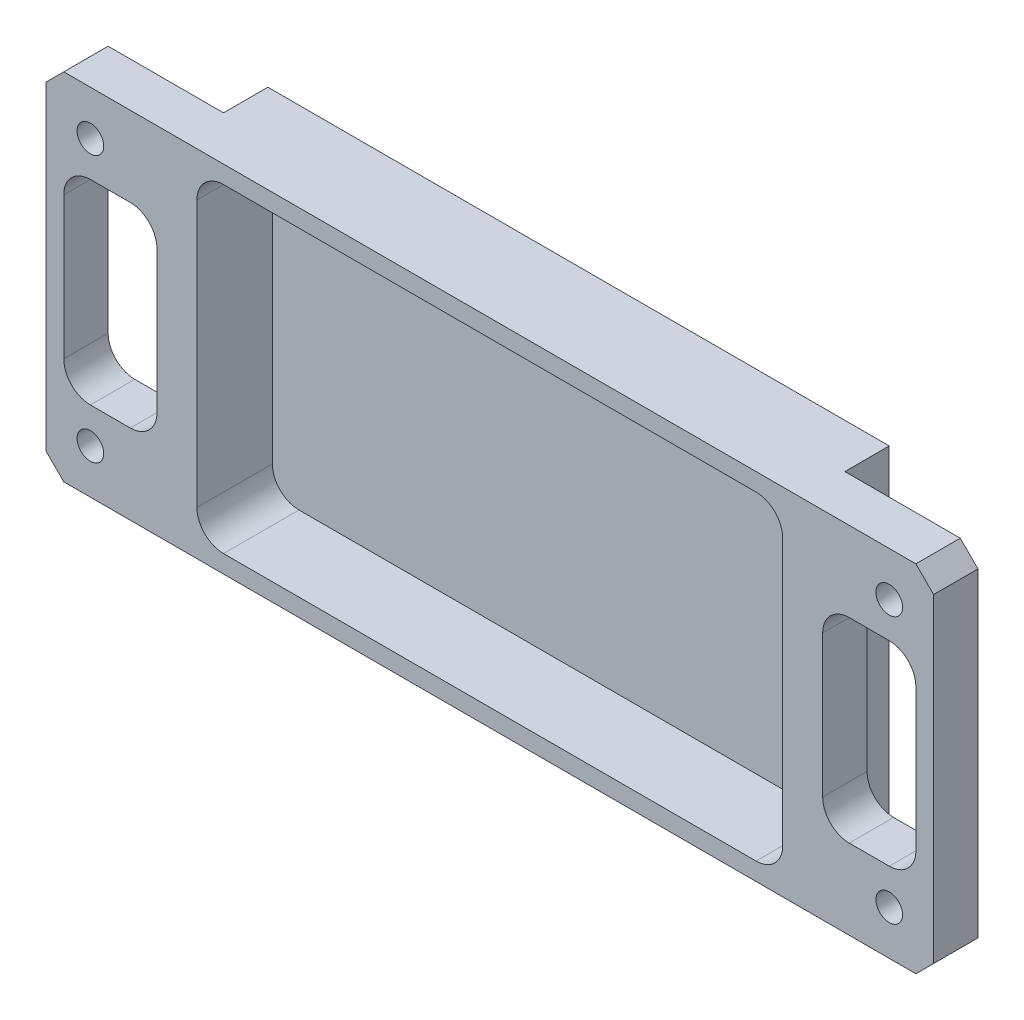
from build123d import *

# Parameters (mm, degrees)
AUFSATZ_LINEAR_AUSTRAGEN1_DEPTH      = 2.5
AUFSATZ_LINEAR_AUSTRAGEN1_DEPTH_BACK = 2.5
SKIZZE1_W                            = 100
SKIZZE1_H                            = 40
SCHNITT_LINEAR_AUSTRAGEN1_DEPTH      = 54.909646632
SCHNITT_LINEAR_AUSTRAGEN1_DEPTH_BACK = 54.909646632
SKIZZE2_R                            = 1.5
SCHNITT_LINEAR_AUSTRAGEN2_DEPTH      = 54.909646632
SCHNITT_LINEAR_AUSTRAGEN2_DEPTH_BACK = 54.909646632
SKIZZE7_W                            = 70
SKIZZE7_H                            = 40
AUFSATZ_LINEAR_AUSTRAGEN3_DEPTH      = 5
SCHNITT_LINEAR_AUSTRAGEN6_DEPTH      = 8.5
FASE1_SIZE                           = 2


with BuildPart() as part:
    # Skizze1 → Aufsatz-Linear austragen1 (new, two sides: drawn at the far end of the back side and taken through both)
    with BuildSketch(Plane.XY.offset(-AUFSATZ_LINEAR_AUSTRAGEN1_DEPTH_BACK)):
        Rectangle(SKIZZE1_W, SKIZZE1_H)
    extrude(amount=AUFSATZ_LINEAR_AUSTRAGEN1_DEPTH + AUFSATZ_LINEAR_AUSTRAGEN1_DEPTH_BACK)

    # Skizze2 → Schnitt-Linear austragen1 (cut, two sides: drawn at the far end of the back side and taken through both)
    with BuildSketch(Plane.XY.offset(-SCHNITT_LINEAR_AUSTRAGEN1_DEPTH_BACK)):
        with Locations((-45, 15)):
            Circle(SKIZZE2_R)
        with Locations(Location((-45, -15, 0), (0, 0, 180))):
            Circle(SKIZZE2_R)
        with Locations((45, -15)):
            Circle(SKIZZE2_R)
        with Locations(Location((45, 15, 0), (0, 0, 180))):
            Circle(SKIZZE2_R)
    extrude(amount=SCHNITT_LINEAR_AUSTRAGEN1_DEPTH + SCHNITT_LINEAR_AUSTRAGEN1_DEPTH_BACK, mode=Mode.SUBTRACT)

    # Skizze4 → Schnitt-Linear austragen2 (cut, two sides: drawn at the far end of the back side and taken through both)
    with BuildSketch(Plane.XY.offset(-SCHNITT_LINEAR_AUSTRAGEN2_DEPTH_BACK)):
        with BuildLine():
            Line((-48, -8), (-48, 8))
            ThreePointArc((-48, 8), (-47.121320344, 10.121320344), (-45, 11))
            Line((-45, 11), (-40.5, 11))
            ThreePointArc((-40.5, 11), (-38.378679656, 10.121320344), (-37.5, 8))
            Line((-37.5, 8), (-37.5, -8))
            ThreePointArc((-37.5, -8), (-38.378679656, -10.121320344), (-40.5, -11))
            Line((-40.5, -11), (-45, -11))
            ThreePointArc((-45, -11), (-47.121320344, -10.121320344), (-48, -8))
        make_face()
        with BuildLine():
            Line((45, -11), (40.5, -11))
            ThreePointArc((40.5, -11), (38.378679656, -10.121320344), (37.5, -8))
            Line((37.5, -8), (37.5, 8))
            ThreePointArc((37.5, 8), (38.378679656, 10.121320344), (40.5, 11))
            Line((40.5, 11), (45, 11))
            ThreePointArc((45, 11), (47.121320344, 10.121320344), (48, 8))
            Line((48, 8), (48, -8))
            ThreePointArc((48, -8), (47.121320344, -10.121320344), (45, -11))
        make_face()
    extrude(amount=SCHNITT_LINEAR_AUSTRAGEN2_DEPTH + SCHNITT_LINEAR_AUSTRAGEN2_DEPTH_BACK, mode=Mode.SUBTRACT)

    # Skizze7 → Aufsatz-Linear austragen3 (add)
    with BuildSketch(Plane(origin=(0, 0, -2.5), x_dir=(-1, 0, 0), z_dir=(0, 0, -1))):
        Rectangle(SKIZZE7_W, SKIZZE7_H)
    extrude(amount=AUFSATZ_LINEAR_AUSTRAGEN3_DEPTH)

    # Skizze8 → Schnitt-Linear austragen6 (cut)
    with BuildSketch(Plane.XY.offset(2.5)):
        with BuildLine():
            Line((33, -15), (33, 15))
            ThreePointArc((33, 15), (32.121320344, 17.121320344), (30, 18))
            Line((30, 18), (-30, 18))
            ThreePointArc((-30, 18), (-32.121320344, 17.121320344), (-33, 15))
            Line((-33, 15), (-33, -15))
            ThreePointArc((-33, -15), (-32.121320344, -17.121320344), (-30, -18))
            Line((-30, -18), (30, -18))
            ThreePointArc((30, -18), (32.121320344, -17.121320344), (33, -15))
        make_face()
    extrude(amount=-SCHNITT_LINEAR_AUSTRAGEN6_DEPTH, mode=Mode.SUBTRACT)

    # Fase1
    fase1_edges = [part.edges().sort_by_distance(p)[0] for p in [
        (50, 20, 0),
        (50, -20, 0),
        (-50, -20, 0),
        (-50, 20, 0),
    ]]
    chamfer(fase1_edges, length=FASE1_SIZE)


solid = part.part
